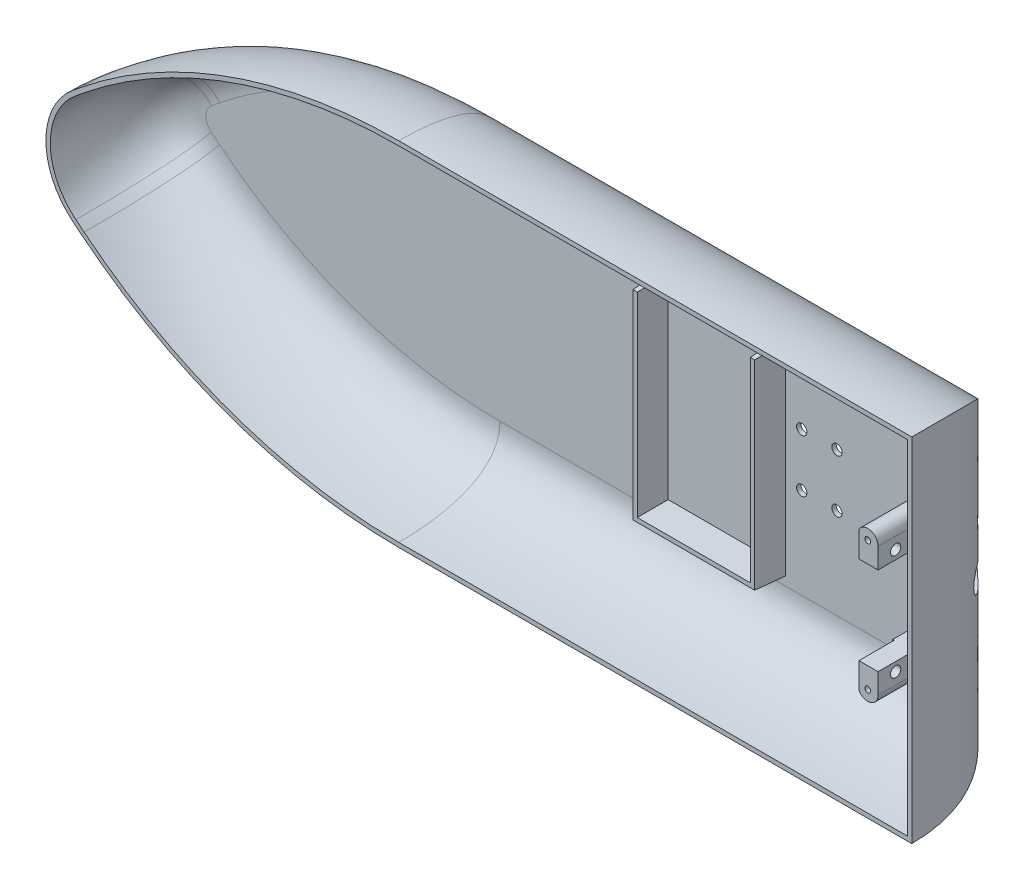
from build123d import *

# Parameters (mm, degrees)
BOSS_EXTRU_1_DEPTH           = 1.5
ENL_V_MAT_EXTRU_1_REACH      = 169.615
ESQUISSE3_R                  = 1.75
BOSS_EXTRU_2_DEPTH           = 10
BOSS_EXTRU_2_DRAFT           = -3
ESQUISSE4_W                  = 32.5
ESQUISSE4_H                  = 2.5
BOSS_EXTRU_2_PROFILE_2_DEPTH = 10
BOSS_EXTRU_2_PROFILE_2_DRAFT = -3
ENL_V_MAT_EXTRU_2_REACH      = 199.892
ESQUISSE8_R                  = 1
BOSS_EXTRU_3_REACH           = 199.892
ESQUISSE9_R                  = 1
ENL_V_MAT_EXTRU_3_DEPTH      = 12
ENL_V_MAT_EXTRU_4_REACH      = 296.679
ESQUISSE11_R                 = 1.75
BOSS_EXTRU_4_REACH           = 296.209
ESQUISSE16_W                 = 15
ESQUISSE16_H                 = 12
ENL_V_MAT_EXTRU_5_REACH      = 358.372
ESQUISSE12_R                 = 4.25
ESQUISSE17_W                 = 4
ESQUISSE17_H                 = 12
ENL_V_MAT_EXTRU_6_DEPTH      = 8


with BuildPart() as part:
    # Esquisse1 → Boss.-Extru.1 (new body)
    with BuildSketch(Plane.XY):
        with BuildLine():
            Line((150.454025839, 73.864865318), (-4.350918075, 73.864865318))
            ThreePointArc((-4.350918075, 73.864865318), (-55.011733191, 65.159871079), (-99.861053968, 40.043471281))
            Line((-99.861053968, 40.043471281), (-102.692538596, 37.750625509))
            ThreePointArc((-102.692538596, 37.750625509), (-104.545974161, 33.864865318), (-102.692538596, 29.979105127))
            Line((-102.692538596, 29.979105127), (-99.861053968, 27.686259355))
            ThreePointArc((-99.861053968, 27.686259355), (-55.011733191, 2.569859558), (-4.350918075, -6.135134682))
            Line((-4.350918075, -6.135134682), (150.454025839, -6.135134682))
            Line((150.454025839, -6.135134682), (150.454025839, 73.864865318))
        make_face()
    extrude(amount=BOSS_EXTRU_1_DEPTH)

    # Esquisse3 → Enlèv. mat.-Extru.1 (cut, up to next)
    with BuildSketch(Plane.XY.offset(1.5), mode=Mode.PRIVATE) as enl_v_mat_extru_1_sk1:
        with Locations((98.454025839, 42.864865318)):
            Circle(ESQUISSE3_R)
    enl_v_mat_extru_1_tool1 = extrude(enl_v_mat_extru_1_sk1.sketch, amount=-ENL_V_MAT_EXTRU_1_REACH, mode=Mode.PRIVATE) & part.part
    # Esquisse3 → Enlèv. mat.-Extru.1 (cut, up to next)
    with BuildSketch(Plane.XY.offset(1.5), mode=Mode.PRIVATE) as enl_v_mat_extru_1_sk2:
        with Locations((98.454025839, 24.864865318)):
            Circle(ESQUISSE3_R)
    enl_v_mat_extru_1_tool2 = extrude(enl_v_mat_extru_1_sk2.sketch, amount=-ENL_V_MAT_EXTRU_1_REACH, mode=Mode.PRIVATE) & part.part
    # Esquisse3 → Enlèv. mat.-Extru.1 (cut, up to next)
    with BuildSketch(Plane.XY.offset(1.5), mode=Mode.PRIVATE) as enl_v_mat_extru_1_sk3:
        with Locations((110.454025839, 24.864865318)):
            Circle(ESQUISSE3_R)
    enl_v_mat_extru_1_tool3 = extrude(enl_v_mat_extru_1_sk3.sketch, amount=-ENL_V_MAT_EXTRU_1_REACH, mode=Mode.PRIVATE) & part.part
    # Esquisse3 → Enlèv. mat.-Extru.1 (cut, up to next)
    with BuildSketch(Plane.XY.offset(1.5), mode=Mode.PRIVATE) as enl_v_mat_extru_1_sk4:
        with Locations((110.454025839, 42.864865318)):
            Circle(ESQUISSE3_R)
    enl_v_mat_extru_1_tool4 = extrude(enl_v_mat_extru_1_sk4.sketch, amount=-ENL_V_MAT_EXTRU_1_REACH, mode=Mode.PRIVATE) & part.part
    add(enl_v_mat_extru_1_tool1.solids().sort_by_distance((98.454026, 42.864865, 1.5))[0], mode=Mode.SUBTRACT)
    add(enl_v_mat_extru_1_tool2.solids().sort_by_distance((98.454026, 24.864865, 1.5))[0], mode=Mode.SUBTRACT)
    add(enl_v_mat_extru_1_tool3.solids().sort_by_distance((110.454026, 24.864865, 1.5))[0], mode=Mode.SUBTRACT)
    add(enl_v_mat_extru_1_tool4.solids().sort_by_distance((110.454026, 42.864865, 1.5))[0], mode=Mode.SUBTRACT)


with BuildPart() as boss_extru_2_tool:
    # Esquisse4 → Boss.-Extru.2 (with draft: the straight prism first)
    with BuildSketch(Plane(origin=(0, 0, 1.5), x_dir=(-1, 0, 0), z_dir=(0, 0, -1))):
        Polygon((-52.954025839, -0.635134682), (-90.454025839, -0.635134682), (-90.454025839, 65.864865318), (-92.954025839, 65.864865318), (-92.954025839, -3.135134682), (-50.454025839, -3.135134682), (-50.454025839, 65.864865318), (-52.954025839, 65.864865318), align=None)
    extrude(amount=-BOSS_EXTRU_2_DEPTH)
    # Boss.-Extru.2: the draft: its side faces are tilted about the plane it starts from
    boss_extru_2_sides = [boss_extru_2_tool.faces().sort_by_distance(p)[0] for p in [
        (71.704025839, -0.635134682, 6.5),
        (90.454025839, 32.614865318, 6.5),
        (91.704025839, 65.864865318, 6.5),
        (92.954025839, 31.364865318, 6.5),
        (71.704025839, -3.135134682, 6.5),
        (50.454025839, 31.364865318, 6.5),
        (51.704025839, 65.864865318, 6.5),
        (52.954025839, 32.614865318, 6.5),
    ]]
    draft(boss_extru_2_sides, Plane(origin=(0, 0, 1.5), x_dir=(-1, 0, 0), z_dir=(0, 0, -1)), BOSS_EXTRU_2_DRAFT)


with BuildPart() as part_1:
    add(part.part)

    # Boss.-Extru.2: add boss_extru_2_tool
    add(boss_extru_2_tool.part)


with BuildPart() as boss_extru_2_profile_2_tool:
    # Esquisse4 → Boss.-Extru.2 profile 2 (with draft: the straight prism first)
    with BuildSketch(Plane(origin=(0, 0, 1.5), x_dir=(-1, 0, 0), z_dir=(0, 0, -1))):
        with Locations((-71.704025839, 69.614865318)):
            Rectangle(ESQUISSE4_W, ESQUISSE4_H)
    extrude(amount=-BOSS_EXTRU_2_PROFILE_2_DEPTH)
    # Boss.-Extru.2 profile 2: the draft: its side faces are tilted about the plane it starts from
    boss_extru_2_profile_2_sides = [boss_extru_2_profile_2_tool.faces().sort_by_distance(p)[0] for p in [
        (55.454025839, 69.614865318, 6.5),
        (71.704025839, 70.864865318, 6.5),
        (87.954025839, 69.614865318, 6.5),
        (71.704025839, 68.364865318, 6.5),
    ]]
    draft(boss_extru_2_profile_2_sides, Plane(origin=(0, 0, 1.5), x_dir=(-1, 0, 0), z_dir=(0, 0, -1)), BOSS_EXTRU_2_PROFILE_2_DRAFT)


with BuildPart() as part_2:
    add(part_1.part)

    # Boss.-Extru.2 profile 2: add boss_extru_2_profile_2_tool
    add(boss_extru_2_profile_2_tool.part)

    # Balayage1: sweep along a path in Esquisse1<2>
    with BuildLine(Plane.XY) as balayage1_path:
        Line((150.454025839, 73.864865318), (-4.350918075, 73.864865318))
        ThreePointArc((-4.350918075, 73.864865318), (-55.011733191, 65.159871079), (-99.861053968, 40.043471281))
        Line((-99.861053968, 40.043471281), (-102.692538596, 37.750625509))
        ThreePointArc((-102.692538596, 37.750625509), (-104.545974161, 33.864865318), (-102.692538596, 29.979105127))
        Line((-102.692538596, 29.979105127), (-99.861053968, 27.686259355))
        ThreePointArc((-99.861053968, 27.686259355), (-55.011733191, 2.569859558), (-4.350918075, -6.135134682))
        Line((-4.350918075, -6.135134682), (150.454025839, -6.135134682))
        Line((150.454025839, -6.135134682), (150.454025839, 73.864865318))
    # Esquisse7 → Balayage1 (sweep)
    with BuildSketch(Plane(origin=(150.454025839, 0, 0), x_dir=(0, 0, -1), z_dir=(1, 0, 0))):
        with BuildLine():
            Line((-1.5, 73.864865318), (0, 73.864865318))
            add(Edge.make_bspline(
                [(0, 73.864865318), (0, 81.337787028), (-5.099638508, 93.803150825), (-36, 93.864865318)],
                knots=[0, 0, 0, 0, 1, 1, 1, 1], degree=3))
            Line((-36, 93.864865318), (-36, 92.364865318))
            add(Edge.make_bspline(
                [(-36, 92.364865318), (-32.824934583, 92.364865318), (-1.5, 92.909703572), (-1.5, 73.864865318)],
                knots=[0, 0, 0, 0, 1, 1, 1, 1], degree=3))
        make_face()
    sweep(path=balayage1_path.line, transition=Transition.RIGHT)

    # Esquisse8 → Enlèv. mat.-Extru.2 (cut, up to next)
    with BuildSketch(Plane(origin=(0, 0, 0), x_dir=(-1, 0, 0), z_dir=(0, 0, -1)), mode=Mode.PRIVATE) as enl_v_mat_extru_2_sk1:
        with Locations((-155.454025839, 55.864865318)):
            Circle(ESQUISSE8_R)
    enl_v_mat_extru_2_tool1 = extrude(enl_v_mat_extru_2_sk1.sketch, amount=-ENL_V_MAT_EXTRU_2_REACH, mode=Mode.PRIVATE) & part_2.part
    # Esquisse8 → Enlèv. mat.-Extru.2 (cut, up to next)
    with BuildSketch(Plane(origin=(0, 0, 0), x_dir=(-1, 0, 0), z_dir=(0, 0, -1)), mode=Mode.PRIVATE) as enl_v_mat_extru_2_sk2:
        with Locations((-155.454025839, 11.864865318)):
            Circle(ESQUISSE8_R)
    enl_v_mat_extru_2_tool2 = extrude(enl_v_mat_extru_2_sk2.sketch, amount=-ENL_V_MAT_EXTRU_2_REACH, mode=Mode.PRIVATE) & part_2.part
    add(enl_v_mat_extru_2_tool1.solids().sort_by_distance((155.454026, 55.864865, 0))[0], mode=Mode.SUBTRACT)
    add(enl_v_mat_extru_2_tool2.solids().sort_by_distance((155.454026, 11.864865, 0))[0], mode=Mode.SUBTRACT)

    # Esquisse9 → Boss.-Extru.3 (add, up to next)
    with BuildSketch(Plane.XY.offset(36), mode=Mode.PRIVATE) as boss_extru_3_sk1:
        with BuildLine():
            Line((151.954025839, 55.864865318), (151.954025839, 48.864865318))
            Line((151.954025839, 48.864865318), (158.954025839, 48.864865318))
            Line((158.954025839, 48.864865318), (158.954025839, 55.864865318))
            ThreePointArc((158.954025839, 55.864865318), (155.454025839, 59.364865318), (151.954025839, 55.864865318))
        make_face()
        with Locations((155.454025839, 55.864865318)):
            Circle(ESQUISSE9_R, mode=Mode.SUBTRACT)
    boss_extru_3_tool1 = extrude(boss_extru_3_sk1.sketch, amount=-BOSS_EXTRU_3_REACH, mode=Mode.PRIVATE) - part_2.part
    # Esquisse9 → Boss.-Extru.3 (add, up to next)
    with BuildSketch(Plane.XY.offset(36), mode=Mode.PRIVATE) as boss_extru_3_sk2:
        with BuildLine():
            Line((158.954025839, 11.864865318), (158.954025839, 18.864865318))
            Line((158.954025839, 18.864865318), (151.954025839, 18.864865318))
            Line((151.954025839, 18.864865318), (151.954025839, 11.864865318))
            ThreePointArc((151.954025839, 11.864865318), (155.454025839, 8.364865318), (158.954025839, 11.864865318))
        make_face()
        with Locations((155.454025839, 11.864865318)):
            Circle(ESQUISSE9_R, mode=Mode.SUBTRACT)
    boss_extru_3_tool2 = extrude(boss_extru_3_sk2.sketch, amount=-BOSS_EXTRU_3_REACH, mode=Mode.PRIVATE) - part_2.part
    add(boss_extru_3_tool1.solids().sort_by_distance((155.454026, 53.669547, 36))[0])
    add(boss_extru_3_tool2.solids().sort_by_distance((155.454026, 14.060183, 36))[0])

    # Esquisse10 → Enlèv. mat.-Extru.3 (cut)
    with BuildSketch(Plane.XY.offset(36)):
        with BuildLine():
            Line((152.454025839, 10.06208968), (152.454025839, 18.864865318))
            Line((152.454025839, 18.864865318), (151.954025839, 18.864865318))
            Line((151.954025839, 18.864865318), (151.954025839, 11.864865318))
            ThreePointArc((151.954025839, 11.864865318), (152.081341448, 10.929450971), (152.454025839, 10.06208968))
        make_face()
        with BuildLine():
            Line((152.454025839, 48.864865318), (152.454025839, 57.667640956))
            ThreePointArc((152.454025839, 57.667640956), (152.081341448, 56.800279665), (151.954025839, 55.864865318))
            Line((151.954025839, 55.864865318), (151.954025839, 48.864865318))
            Line((151.954025839, 48.864865318), (152.454025839, 48.864865318))
        make_face()
    extrude(amount=-ENL_V_MAT_EXTRU_3_DEPTH, mode=Mode.SUBTRACT)

    # Esquisse11 → Enlèv. mat.-Extru.4 (cut, up to next)
    with BuildSketch(Plane.ZY.offset(-152.454025839), mode=Mode.PRIVATE) as enl_v_mat_extru_4_sk1:
        with Locations((30, 51.864865318)):
            Circle(ESQUISSE11_R)
    enl_v_mat_extru_4_tool1 = extrude(enl_v_mat_extru_4_sk1.sketch, amount=-ENL_V_MAT_EXTRU_4_REACH, mode=Mode.PRIVATE) & part_2.part
    # Esquisse11 → Enlèv. mat.-Extru.4 (cut, up to next)
    with BuildSketch(Plane.ZY.offset(-152.454025839), mode=Mode.PRIVATE) as enl_v_mat_extru_4_sk2:
        with Locations((30, 15.864865318)):
            Circle(ESQUISSE11_R)
    enl_v_mat_extru_4_tool2 = extrude(enl_v_mat_extru_4_sk2.sketch, amount=-ENL_V_MAT_EXTRU_4_REACH, mode=Mode.PRIVATE) & part_2.part
    add(enl_v_mat_extru_4_tool1.solids().sort_by_distance((152.454026, 51.864865, 30))[0], mode=Mode.SUBTRACT)
    add(enl_v_mat_extru_4_tool2.solids().sort_by_distance((152.454026, 15.864865, 30))[0], mode=Mode.SUBTRACT)

    # Esquisse16 → Boss.-Extru.4 (add, up to next)
    with BuildSketch(Plane.ZY.offset(-151.954025839), mode=Mode.PRIVATE) as boss_extru_4_sk1:
        with Locations((9.067319999, 33.864865318)):
            Rectangle(ESQUISSE16_W, ESQUISSE16_H)
    boss_extru_4_tool1 = extrude(boss_extru_4_sk1.sketch, amount=-BOSS_EXTRU_4_REACH, mode=Mode.PRIVATE) - part_2.part
    add(boss_extru_4_tool1.solids().sort_by_distance((151.954026, 33.864865, 9.06732))[0])

    # Enlèv. mat.-Extru.5: up to this plane
    enl_v_mat_extru_5_end = Plane(origin=(151.954025839, 0, 0), z_dir=(-1, 0, 0))
    # Esquisse12 → Enlèv. mat.-Extru.5 (cut, up to the surface)
    with BuildSketch(Plane(origin=(201.402884097, 0, -73.304654907), x_dir=(-0.34202014332566427, 0, -0.93969262078591), z_dir=(0.93969262078591, -1.2457869471927707e-15, -0.34202014332566427)), mode=Mode.PRIVATE) as enl_v_mat_extru_5_sk1:
        with Locations((-61.752546666, 33.864865318)):
            Circle(ESQUISSE12_R)
    enl_v_mat_extru_5_tool1 = split(extrude(enl_v_mat_extru_5_sk1.sketch, amount=-ENL_V_MAT_EXTRU_5_REACH, mode=Mode.PRIVATE), bisect_by=enl_v_mat_extru_5_end, keep=Keep.BOTH, mode=Mode.PRIVATE)
    add(enl_v_mat_extru_5_tool1.solids().sort_by_distance((222.523499, 33.864865, -15.276242))[0], mode=Mode.SUBTRACT)

    # Esquisse17 → Enlèv. mat.-Extru.6 (cut)
    with BuildSketch(Plane.XY.offset(16.567319999)):
        with Locations((158.954025839, 33.864865318)):
            Rectangle(ESQUISSE17_W, ESQUISSE17_H)
    extrude(amount=-ENL_V_MAT_EXTRU_6_DEPTH, mode=Mode.SUBTRACT)


solid = part_2.part
